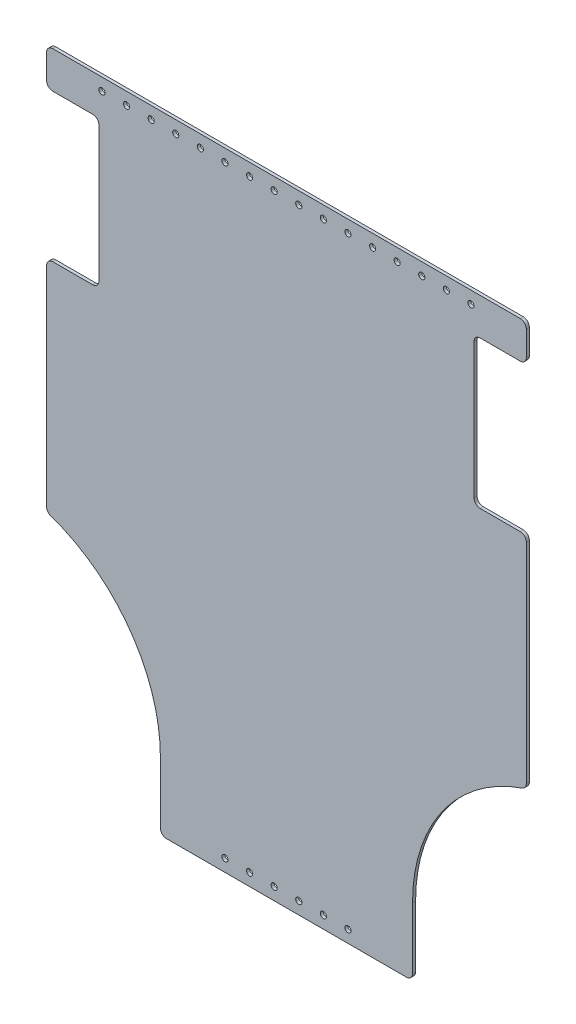
from build123d import *

# Parameters (mm, degrees)
BOSS_EXTRUDE1_DEPTH = 3.175
CUT_EXTRUDE1_DEPTH  = 403.674624387
SKETCH3_W           = 260.35
SKETCH3_H           = 3.175
BOSS_EXTRUDE2_DEPTH = 12.7
FILLET1_R           = 6.35
SKETCH5_R           = 3.175
CUT_EXTRUDE2_DEPTH  = 413.762211358


with BuildPart() as part:
    # Sketch1 → Boss-Extrude1 (new body)
    with BuildSketch(Plane.XY):
        Polygon((-247.65, 127), (-247.65, -317.5), (247.65, -317.5), (247.65, 127), (193.675, 127), (193.675, 279.4), (247.65, 279.4), (247.65, 317.5), (-247.65, 317.5), (-247.65, 279.4), (-193.675, 279.4), (-193.675, 127), align=None)
    extrude(amount=BOSS_EXTRUDE1_DEPTH)

    # Sketch2 → Cut-Extrude1 (cut, through all)
    with BuildSketch(Plane(origin=(0, 0, 0), x_dir=(-1, 0, 0), z_dir=(0, 0, -1))):
        with BuildLine():
            Line((-130.175, -260.35), (-130.175, -324.332629374))
            Line((-130.175, -324.332629374), (-142.81356865, -324.332629374))
            ThreePointArc((-142.81356865, -324.332629374), (-463.535123664, -227.740529446), (-130.175, -260.35))
        make_face()
        with BuildLine():
            Line((130.175, -324.332629374), (142.81356865, -324.332629374))
            ThreePointArc((142.81356865, -324.332629374), (463.535123664, -227.740529446), (130.175, -260.35))
            Line((130.175, -260.35), (130.175, -324.332629374))
        make_face()
    extrude(amount=-CUT_EXTRUDE1_DEPTH, mode=Mode.SUBTRACT)

    # Sketch3 → Boss-Extrude2 (add)
    with BuildSketch(Plane.XZ.offset(317.5)):
        with Locations((0, 1.5875)):
            Rectangle(SKETCH3_W, SKETCH3_H)
    extrude(amount=BOSS_EXTRUDE2_DEPTH)

    # Fillet1
    fillet1_edges = [part.edges().sort_by_distance(p)[0] for p in [
        (-247.65, 317.5, 1.5875),
        (247.65, 317.5, 1.5875),
        (247.65, 279.4, 1.5875),
        (193.675, 279.4, 1.5875),
        (193.675, 127, 1.5875),
        (247.65, 127, 1.5875),
        (-247.65, 127, 1.5875),
        (-193.675, 127, 1.5875),
        (-193.675, 279.4, 1.5875),
        (-247.65, 279.4, 1.5875),
        (247.65, -99.926075272, 1.5875),
        (-247.65, -99.926075272, 1.5875),
        (-130.175, -330.2, 1.5875),
        (130.175, -330.2, 1.5875),
    ]]
    fillet(fillet1_edges, radius=FILLET1_R)

    # Sketch5 → Cut-Extrude2 (cut, through all)
    with BuildSketch(Plane(origin=(0, 0, 0), x_dir=(-1, 0, 0), z_dir=(0, 0, -1))):
        with Locations((63.5, -317.5)):
            Circle(SKETCH5_R)
        with Locations((38.1, -317.5)):
            Circle(SKETCH5_R)
        with Locations((12.7, -317.5)):
            Circle(SKETCH5_R)
        with Locations((-12.7, -317.5)):
            Circle(SKETCH5_R)
        with Locations((-38.1, -317.5)):
            Circle(SKETCH5_R)
        with Locations((-63.5, -317.5)):
            Circle(SKETCH5_R)
        with Locations((190.5, 304.8)):
            Circle(SKETCH5_R)
        with Locations((165.1, 304.8)):
            Circle(SKETCH5_R)
        with Locations((139.7, 304.8)):
            Circle(SKETCH5_R)
        with Locations((114.3, 304.8)):
            Circle(SKETCH5_R)
        with Locations((88.9, 304.8)):
            Circle(SKETCH5_R)
        with Locations((63.5, 304.8)):
            Circle(SKETCH5_R)
        with Locations((38.1, 304.8)):
            Circle(SKETCH5_R)
        with Locations((12.7, 304.8)):
            Circle(SKETCH5_R)
        with Locations((-12.7, 304.8)):
            Circle(SKETCH5_R)
        with Locations((-38.1, 304.8)):
            Circle(SKETCH5_R)
        with Locations((-63.5, 304.8)):
            Circle(SKETCH5_R)
        with Locations((-88.9, 304.8)):
            Circle(SKETCH5_R)
        with Locations((-114.3, 304.8)):
            Circle(SKETCH5_R)
        with Locations((-139.7, 304.8)):
            Circle(SKETCH5_R)
        with Locations((-165.1, 304.8)):
            Circle(SKETCH5_R)
        with Locations((-190.5, 304.8)):
            Circle(SKETCH5_R)
    extrude(amount=-CUT_EXTRUDE2_DEPTH, mode=Mode.SUBTRACT)


solid = part.part
